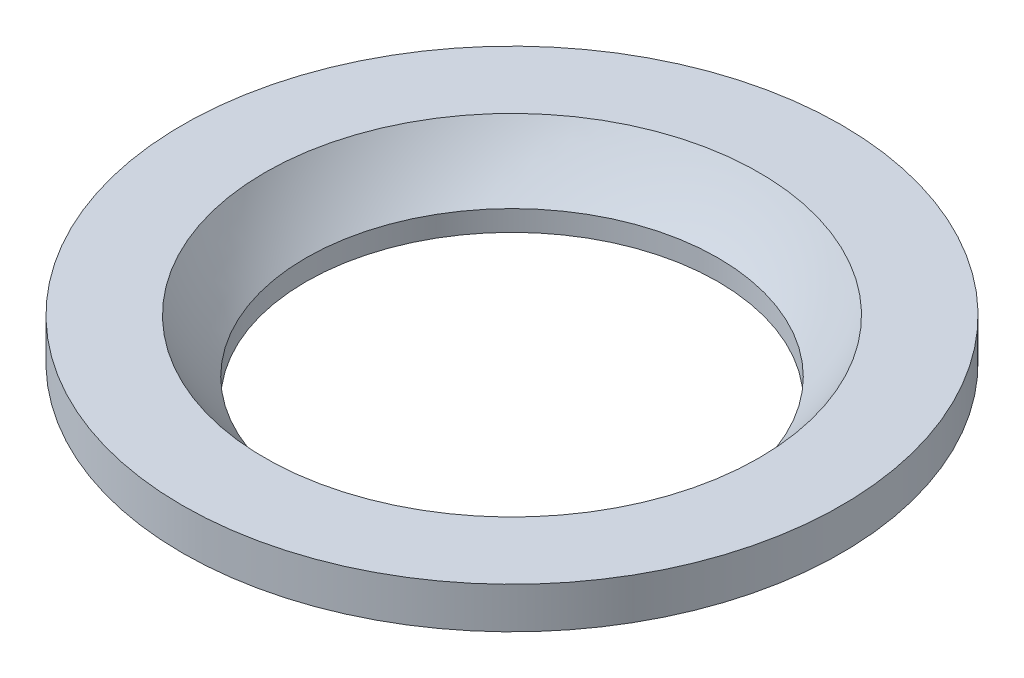
from build123d import *


with BuildPart() as part:
    # Esquisse1 → Révolution1 (revolve)
    with BuildSketch(Plane.XY, mode=Mode.PRIVATE) as r_volution1_sk:
        with BuildLine():
            Line((6, -3.605551275), (8, -3.605551275))
            Line((8, -3.605551275), (8, -4.605551275))
            Line((8, -4.605551275), (7.5, -4.605551275))
            ThreePointArc((7.5, -4.605551275), (6.316881892, -5.213002441), (5, -5.398979486))
            Line((5, -5.398979486), (5, -4.898979486))
            ThreePointArc((5, -4.898979486), (5.537891217, -4.281560564), (6, -3.605551275))
        make_face()
    revolve(r_volution1_sk.sketch.rotate(Axis((0, 0, 0), (0, -1, 0)), 90), axis=Axis((0, 0, 0), (0, -1, 0)))


solid = part.part
